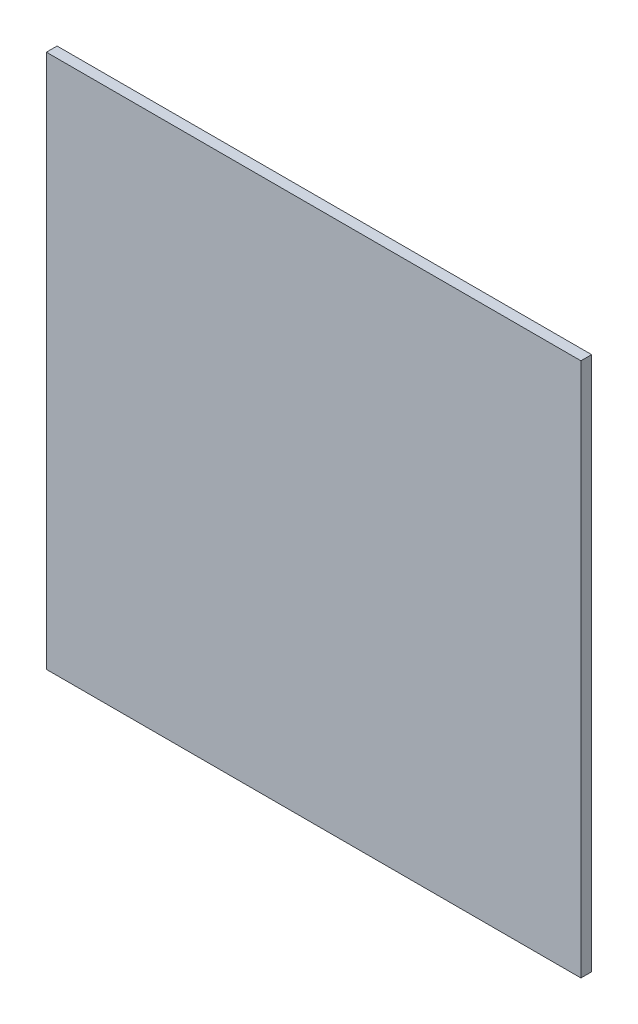
from build123d import *

# Parameters (mm, degrees)
ESBO_O1_W                = 150
ESBO_O1_H                = 150
RESSALTO_EXTRUS_O1_DEPTH = 3


with BuildPart() as part:
    # Esboço1 → Ressalto-extrusão1 (new body)
    with BuildSketch(Plane.XY):
        Rectangle(ESBO_O1_W, ESBO_O1_H)
    extrude(amount=RESSALTO_EXTRUS_O1_DEPTH)


solid = part.part
